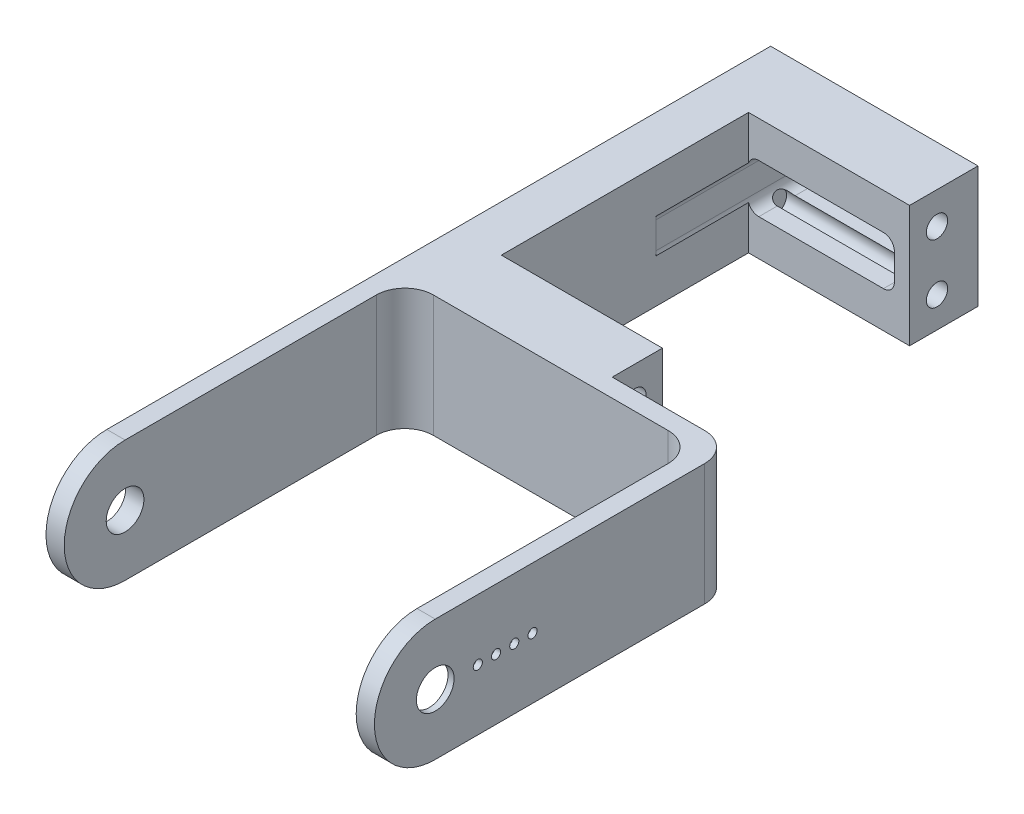
from build123d import *

# Parameters (mm, degrees)
AUFSATZ_LINEAR_AUSTRAGEN1_DEPTH      = 20
SCHNITT_LINEAR_AUSTRAGEN1_DEPTH      = 79.7
SKIZZE3_R                            = 3.1
SCHNITT_LINEAR_AUSTRAGEN2_DEPTH      = 94.75
SCHNITT_LINEAR_AUSTRAGEN3_DEPTH      = 2
SKIZZE5_R                            = 0.75
SCHNITT_LINEAR_AUSTRAGEN4_DEPTH      = 2
AUFSATZ_LINEAR_AUSTRAGEN2_DEPTH      = 20
SKIZZE7_W                            = 7.611739691
SKIZZE7_H                            = 51.890970688
AUFSATZ_LINEAR_AUSTRAGEN3_DEPTH      = 20
SKIZZE8_W                            = 11.248625368
SKIZZE8_H                            = 20
AUFSATZ_LINEAR_AUSTRAGEN4_DEPTH      = 26.48
SCHNITT_LINEAR_AUSTRAGEN5_DEPTH      = 26.48
SCHNITT_LINEAR_AUSTRAGEN6_DEPTH      = 6
SCHNITT_LINEAR_AUSTRAGEN6_DEPTH_BACK = 26.48
SKIZZE10_R                           = 1.75
SKIZZE11_R                           = 3
AUFSATZ_LINEAR_AUSTRAGEN5_DEPTH      = 6


with BuildPart() as part:
    # Skizze1 → Aufsatz-Linear austragen1 (new body)
    with BuildSketch(Plane(origin=(0, 0, 0), x_dir=(1, 0, 0), z_dir=(0, 1, 0))):
        with BuildLine():
            Line((0, 59), (0, 0))
            Line((0, 0), (3, 0))
            Line((3, 0), (3, 51.3))
            ThreePointArc((3, 51.3), (4.376598128, 54.623401872), (7.7, 56))
            Line((7.7, 56), (46.3, 56))
            ThreePointArc((46.3, 56), (49.623401872, 54.623401872), (51, 51.3))
            Line((51, 51.3), (51, 0))
            Line((51, 0), (54, 0))
            Line((54, 0), (54, 54.3))
            ThreePointArc((54, 54.3), (52.623401872, 57.623401872), (49.3, 59))
            Line((49.3, 59), (0, 59))
        make_face()
    extrude(amount=AUFSATZ_LINEAR_AUSTRAGEN1_DEPTH)

    # Skizze2 → Schnitt-Linear austragen1 (cut)
    with BuildSketch(Plane(origin=(54, 0, 0), x_dir=(0, 0, -1), z_dir=(1, 0, 0))):
        with BuildLine():
            ThreePointArc((0, 10), (2.928932188, 17.071067812), (10, 20))
            Line((10, 20), (0, 20))
            Line((0, 20), (0, 10))
        make_face()
        with BuildLine():
            ThreePointArc((10, 0), (2.928932188, 2.928932188), (0, 10))
            Line((0, 10), (0, 0))
            Line((0, 0), (10, 0))
        make_face()
    extrude(amount=-SCHNITT_LINEAR_AUSTRAGEN1_DEPTH, mode=Mode.SUBTRACT)

    # Skizze3 → Schnitt-Linear austragen2 (cut)
    with BuildSketch(Plane(origin=(54, 0, 0), x_dir=(0, 0, -1), z_dir=(1, 0, 0))):
        with Locations((10, 10)):
            Circle(SKIZZE3_R)
    extrude(amount=-SCHNITT_LINEAR_AUSTRAGEN2_DEPTH, mode=Mode.SUBTRACT)

    # Skizze4 → Schnitt-Linear austragen3 (cut)
    with BuildSketch(Plane.ZY.offset(-51)):
        with BuildLine():
            Line((-27.5, 12.5), (-14.807252725, 14.374965285))
            ThreePointArc((-14.807252725, 14.374965285), (-3.5, 10), (-14.807252725, 5.625034715))
            Line((-14.807252725, 5.625034715), (-27.5, 7.5))
            ThreePointArc((-27.5, 7.5), (-30, 10), (-27.5, 12.5))
        make_face()
    extrude(amount=-SCHNITT_LINEAR_AUSTRAGEN3_DEPTH, mode=Mode.SUBTRACT)

    # Skizze5 → Schnitt-Linear austragen4 (cut)
    with BuildSketch(Plane.ZY.offset(-53)):
        with Locations((-25.995480757, 10)):
            Circle(SKIZZE5_R)
        with Locations((-22.995480757, 10)):
            Circle(SKIZZE5_R)
        with Locations((-19.995480757, 10)):
            Circle(SKIZZE5_R)
        with Locations((-16.995480757, 10)):
            Circle(SKIZZE5_R)
    extrude(amount=-SCHNITT_LINEAR_AUSTRAGEN4_DEPTH, mode=Mode.SUBTRACT)

    # Skizze6 → Aufsatz-Linear austragen2 (add)
    with BuildSketch(Plane.XZ):
        Polygon((34.094038703, -59.256850744), (34.094038703, -67.256850744), (0, -67.256850744), (0, -59.256850744), (0, -57.894447073), (34.094038703, -57.894447073), align=None)
    extrude(amount=-AUFSATZ_LINEAR_AUSTRAGEN2_DEPTH)

    # Skizze7 → Aufsatz-Linear austragen3 (add)
    with BuildSketch(Plane.XZ):
        with Locations((3.805869846, -93.202336088)):
            Rectangle(SKIZZE7_W, SKIZZE7_H)
    extrude(amount=-AUFSATZ_LINEAR_AUSTRAGEN3_DEPTH)

    # Skizze8 → Aufsatz-Linear austragen4 (add)
    with BuildSketch(Plane(origin=(7.611739691, 0, 0), x_dir=(0, 0, -1), z_dir=(1, 0, 0))):
        with Locations((113.523508748, 10)):
            Rectangle(SKIZZE8_W, SKIZZE8_H)
    extrude(amount=AUFSATZ_LINEAR_AUSTRAGEN4_DEPTH)

    # Skizze9 → Schnitt-Linear austragen5 (cut)
    with BuildSketch(Plane(origin=(0, 0, -119.147821432), x_dir=(-1, 0, 0), z_dir=(0, 0, -1))):
        with BuildLine():
            Line((-9.3, 14), (-29.794038703, 14))
            ThreePointArc((-29.794038703, 14), (-31.066830909, 13.472792206), (-31.594038703, 12.2))
            Line((-31.594038703, 12.2), (-31.594038703, 7.8))
            ThreePointArc((-31.594038703, 7.8), (-31.066830909, 6.527207794), (-29.794038703, 6))
            Line((-29.794038703, 6), (-9.3, 6))
            ThreePointArc((-9.3, 6), (-8.027207794, 6.527207794), (-7.5, 7.8))
            Line((-7.5, 7.8), (-7.5, 12.2))
            ThreePointArc((-7.5, 12.2), (-8.027207794, 13.472792206), (-9.3, 14))
        make_face()
    extrude(amount=-SCHNITT_LINEAR_AUSTRAGEN5_DEPTH, mode=Mode.SUBTRACT)

    # Skizze10 → Schnitt-Linear austragen6 (cut, two sides: drawn at the far end of the back side and taken through both)
    with BuildSketch(Plane(origin=(34.091739691, 0, 0), x_dir=(0, 0, -1), z_dir=(1, 0, 0)).offset(-SCHNITT_LINEAR_AUSTRAGEN6_DEPTH_BACK)):
        with Locations((62.806850744, 14.75)):
            Circle(SKIZZE10_R)
        with Locations((62.806850744, 5.05)):
            Circle(SKIZZE10_R)
        with Locations(Location((112.406850744, 5.05, 0), (0, 0, 180))):
            Circle(SKIZZE10_R)
        with Locations(Location((112.406850744, 14.75, 0), (0, 0, 180))):
            Circle(SKIZZE10_R)
    extrude(amount=SCHNITT_LINEAR_AUSTRAGEN6_DEPTH + SCHNITT_LINEAR_AUSTRAGEN6_DEPTH_BACK, mode=Mode.SUBTRACT)

    # Skizze11 → Aufsatz-Linear austragen5 (add)
    with BuildSketch(Plane.ZY):
        with Locations((-99.456850744, 9.9)):
            Circle(SKIZZE11_R)
    extrude(amount=AUFSATZ_LINEAR_AUSTRAGEN5_DEPTH)


solid = part.part
